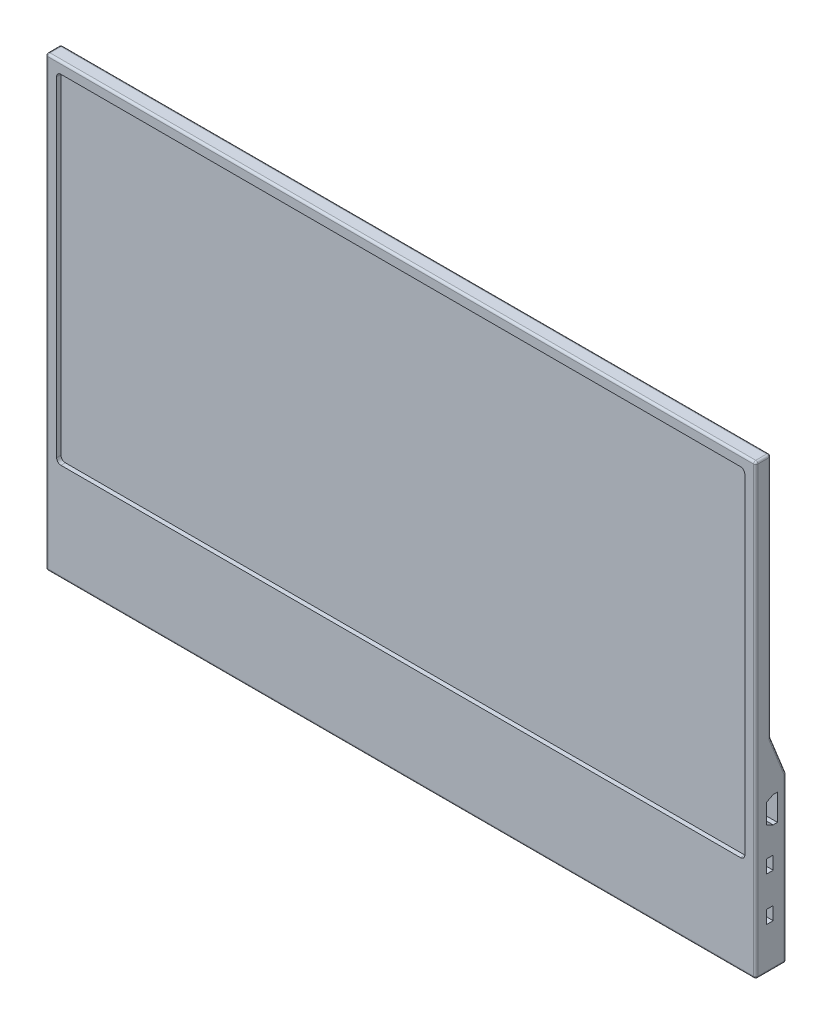
from build123d import *

# Parameters (mm, degrees)
SKETCH_1_W                  = 325
SKETCH_1_H                  = 205
EXTRUDE_1_DEPTH             = 14
SKETCH_2_W                  = 7
SKETCH_2_H                  = 130
CUT_EXTRUDE_1_DEPTH         = 341.852240714
CUT_EXTRUDE_2_DEPTH         = 10
SKETCH_4_W                  = 3
SKETCH_4_H                  = 6
CUT_EXTRUDE_3_DEPTH         = 10
SKETCH_5_W                  = 3
SKETCH_5_H                  = 6
CUT_EXTRUDE_4_DEPTH         = 10
SKETCH_6_W                  = 315
SKETCH_6_H                  = 155
CUT_EXTRUDE_5_DEPTH         = 2
DRAFT_1_ANGLE               = 68.198590514
HOLE_WIZARD_3_5_3_5_1_D     = 3.5
HOLE_WIZARD_3_5_3_5_1_DEPTH = 5
FILLET_1_R                  = 1
FILLET_2_R                  = 2


with BuildPart() as part:
    # 草图1 → 凸台-拉伸1 (new body)
    with BuildSketch(Plane.XY.offset(7)):
        Rectangle(SKETCH_1_W, SKETCH_1_H)
    extrude(amount=-EXTRUDE_1_DEPTH)

    # 草图2 → 切除-拉伸1 (cut, through all)
    with BuildSketch(Plane(origin=(162.5, 0, 0), x_dir=(0, 0, -1), z_dir=(1, 0, 0))):
        with Locations((3.5, 37.5)):
            Rectangle(SKETCH_2_W, SKETCH_2_H)
    extrude(amount=-CUT_EXTRUDE_1_DEPTH, mode=Mode.SUBTRACT)

    # 草图3 → 切除-拉伸2 (cut)
    with BuildSketch(Plane(origin=(162.5, 0, 0), x_dir=(0, 0, -1), z_dir=(1, 0, 0))):
        Polygon((-2, -43.5), (0.946428571, -45), (2.946428571, -45), (2.946428571, -33), (0.946428571, -33), (-2, -34.5), align=None)
    extrude(amount=-CUT_EXTRUDE_2_DEPTH, mode=Mode.SUBTRACT)

    # 草图4 → 切除-拉伸3 (cut)
    with BuildSketch(Plane(origin=(162.5, 0, 0), x_dir=(0, 0, -1), z_dir=(1, 0, 0))):
        with Locations((-0.5, -60)):
            Rectangle(SKETCH_4_W, SKETCH_4_H)
    extrude(amount=-CUT_EXTRUDE_3_DEPTH, mode=Mode.SUBTRACT)

    # 草图5 → 切除-拉伸4 (cut)
    with BuildSketch(Plane(origin=(162.5, 0, 0), x_dir=(0, 0, -1), z_dir=(1, 0, 0))):
        with Locations((-0.5, -80)):
            Rectangle(SKETCH_5_W, SKETCH_5_H)
    extrude(amount=-CUT_EXTRUDE_4_DEPTH, mode=Mode.SUBTRACT)

    # 草图6 → 切除-拉伸5 (cut)
    with BuildSketch(Plane.XY.offset(7)):
        with Locations((0, 20)):
            Rectangle(SKETCH_6_W, SKETCH_6_H)
    extrude(amount=-CUT_EXTRUDE_5_DEPTH, mode=Mode.SUBTRACT)

    # 拔模1
    draft_1_faces = [part.faces().sort_by_distance(p)[0] for p in [
        (0, -27.5, -3.5),
    ]]
    draft(draft_1_faces, Plane(origin=(0, 0, -7), x_dir=(-1, 0, 0), z_dir=(0, 0, -1)), DRAFT_1_ANGLE)

    # Ø3.5 (3.5) 直径孔1
    with Locations(Plane(origin=(0, 0, -7), x_dir=(-1, 0, 0), z_dir=(0, 0, -1))):
        with Locations((-37.55, -37.75), (37.55, -37.75)):
            Hole(HOLE_WIZARD_3_5_3_5_1_D / 2, depth=HOLE_WIZARD_3_5_3_5_1_DEPTH)

    # 圆角1
    fillet_1_edges = [part.edges().sort_by_distance(p)[0] for p in [
        (-162.5, -65, -7),
        (162.5, 102.5, 3.5),
        (-162.5, 102.5, 3.5),
        (-162.5, -18.75, -3.5),
        (0, -27.5, -7),
        (-162.5, 46.25, 0),
        (0, -10, 0),
        (0, 102.5, 0),
        (162.5, 46.25, 0),
        (162.5, -18.75, -3.5),
        (0, -102.5, -7),
        (-162.5, 0, 7),
        (0, 102.5, 7),
        (162.5, 0, 7),
        (0, -102.5, 7),
        (-162.5, -102.5, 0),
        (162.5, -102.5, 0),
        (162.5, -65, -7),
    ]]
    fillet(fillet_1_edges, radius=FILLET_1_R)

    # 圆角2
    fillet_2_edges = [part.edges().sort_by_distance(p)[0] for p in [
        (-157.5, -57.5, 6),
        (-157.5, 97.5, 6),
        (157.5, 97.5, 6),
        (157.5, -57.5, 6),
    ]]
    fillet(fillet_2_edges, radius=FILLET_2_R)


solid = part.part
